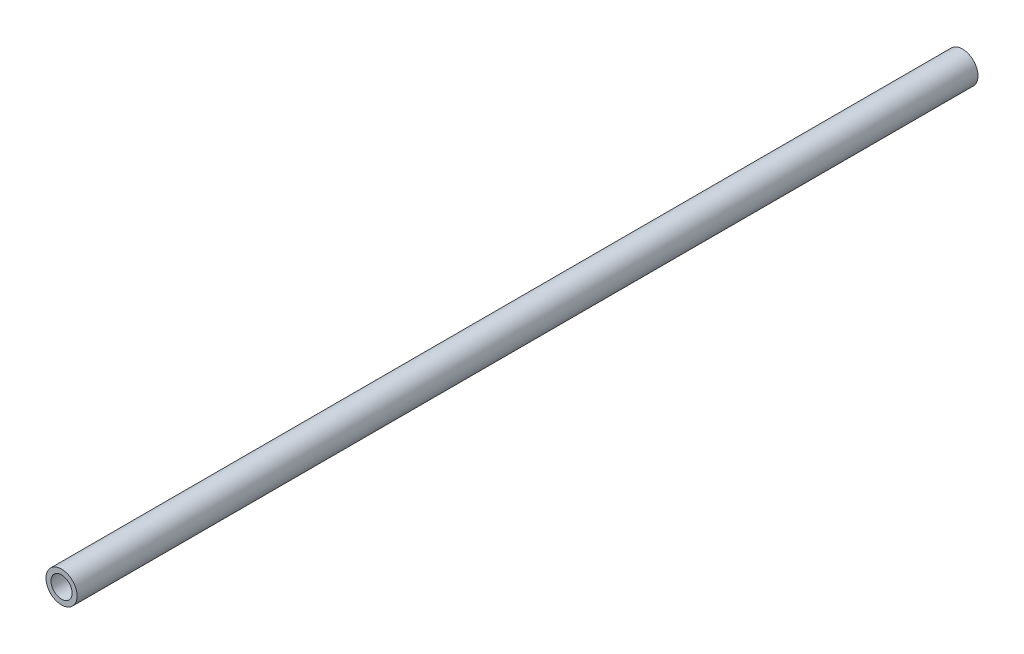
from build123d import *

# Parameters (mm, degrees)
BOSS_EXTRUDE1_DEPTH      = 30
BOSS_EXTRUDE1_DEPTH_BACK = 240
SKETCH1_R                = 4.663580846
SKETCH1_R_2              = 3.163580846


with BuildPart() as part:
    # Sketch1 → Boss-Extrude1 (new, two sides: drawn at the far end of the back side and taken through both)
    with BuildSketch(Plane.XY.offset(-BOSS_EXTRUDE1_DEPTH_BACK)):
        with Locations((-100, 100)):
            Circle(SKETCH1_R)
        with Locations((-100, 100)):
            Circle(SKETCH1_R_2, mode=Mode.SUBTRACT)
    extrude(amount=BOSS_EXTRUDE1_DEPTH + BOSS_EXTRUDE1_DEPTH_BACK)


solid = part.part
